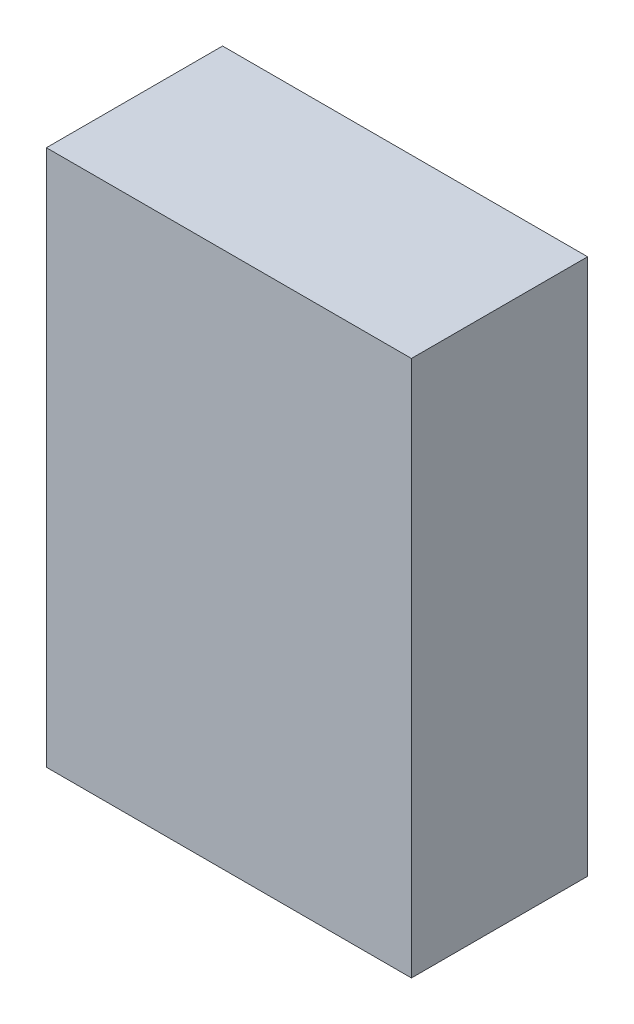
from build123d import *

# Parameters (mm, degrees)
SKETCH1_W      = 27.56
SKETCH1_H      = 40.51
ENVELOPE_DEPTH = 13.3


with BuildPart() as part:
    # Sketch1 → Envelope (new body)
    with BuildSketch(Plane.XY):
        Rectangle(SKETCH1_W, SKETCH1_H)
    extrude(amount=ENVELOPE_DEPTH)


solid = part.part
